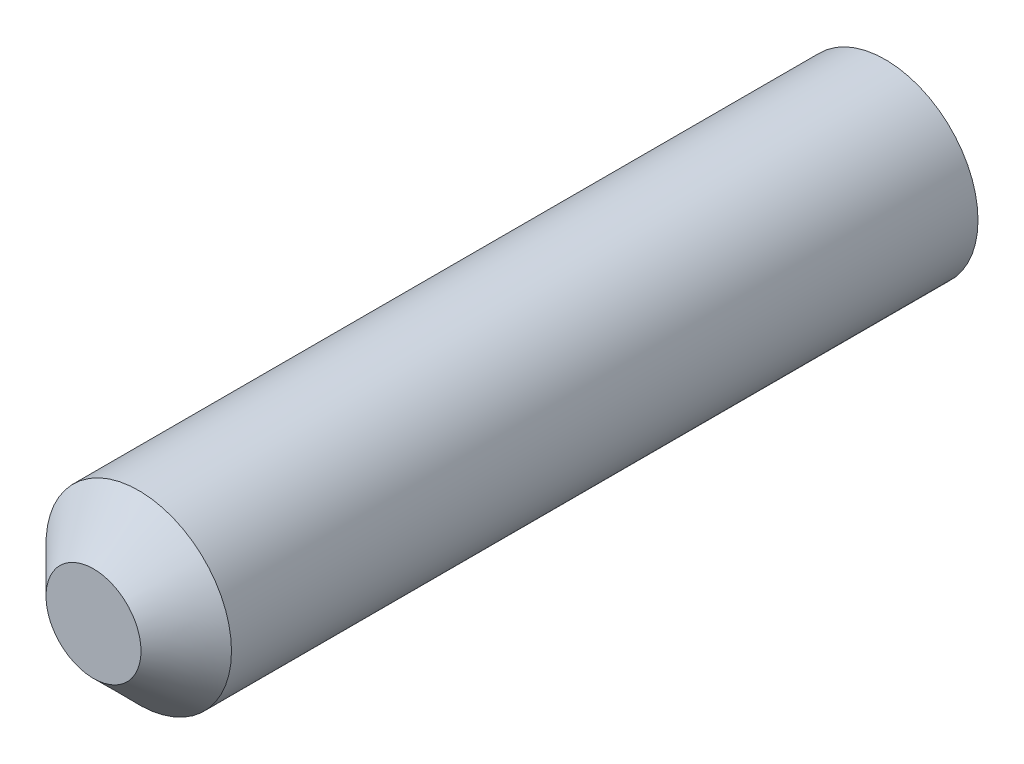
from build123d import *

# Parameters (mm, degrees)
SCHIZZO1_R                   = 2.05
ESTRUSIONE_ESTRUSIONE1_DEPTH = 17.5
SMUSSO1_SIZE                 = 1


with BuildPart() as part:
    # Schizzo1 → Estrusione-Estrusione1 (new body)
    with BuildSketch(Plane.XY):
        Circle(SCHIZZO1_R)
    extrude(amount=ESTRUSIONE_ESTRUSIONE1_DEPTH)

    # Smusso1
    smusso1_edges = [part.edges().sort_by_distance(p)[0] for p in [
        (-2.05, 0, 17.5),
    ]]
    chamfer(smusso1_edges, length=SMUSSO1_SIZE)


solid = part.part
